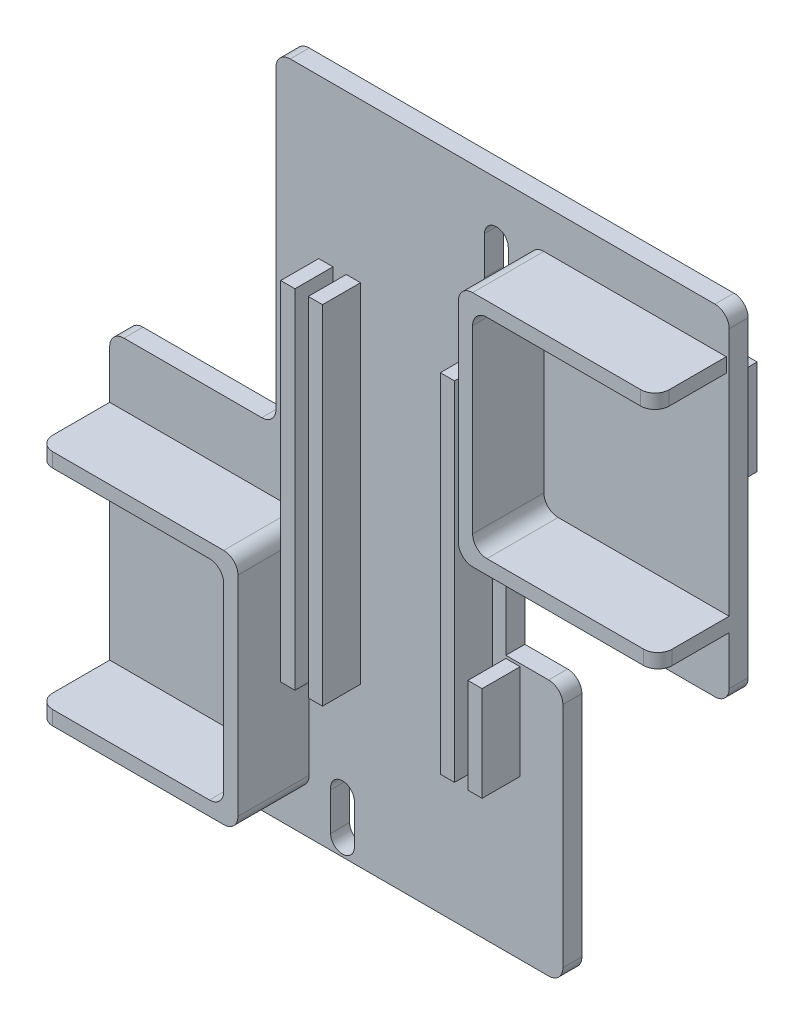
from build123d import *

# Parameters (mm, degrees)
SKETCH3_W             = 1.5
SKETCH3_H             = 36.6
BOSS_EXTRUDE1_DEPTH   = 4
BOSS_EXTRUDE1_2_DEPTH = 4
BOSS_EXTRUDE1_3_DEPTH = 4
BOSS_EXTRUDE1_4_DEPTH = 4
SKETCH4_W             = 65.2
SKETCH4_H             = 70
BOSS_EXTRUDE2_DEPTH   = 2
BOSS_EXTRUDE3_DEPTH   = 7.5
SKETCH6_W             = 17.5
SKETCH6_H             = 29.2
CUT_EXTRUDE1_DEPTH    = 4
SKETCH10_R            = 1.5
CUT_EXTRUDE5_DEPTH    = 20
SKETCH11_W            = 23.629808973
SKETCH11_H            = 13.794178538
SKETCH11_W_2          = 19.491555411
SKETCH11_H_2          = 12.733087881
CUT_EXTRUDE6_DEPTH    = 20
SKETCH13_W            = 4
SKETCH13_H            = 16.6
CUT_EXTRUDE7_DEPTH    = 2
SKETCH15_W            = 6
SKETCH15_H            = 11.6
CUT_EXTRUDE8_DEPTH    = 2
CUT_EXTRUDE9_DEPTH    = 2
FILLET1_R             = 1.5
CUT_EXTRUDE11_DEPTH   = 2
FILLET2_R             = 1.5
SKETCH19_W            = 10
SKETCH19_H            = 10
BOSS_EXTRUDE5_DEPTH   = 4.95


with BuildPart() as part:
    # Sketch3 → Boss-Extrude1 (new body)
    with BuildSketch(Plane.XY):
        with Locations((-6.95, 0)):
            Rectangle(SKETCH3_W, SKETCH3_H)
    extrude(amount=BOSS_EXTRUDE1_DEPTH)



with BuildPart() as body_2:
    # Sketch3 → Boss-Extrude1 2 (new body)
    with BuildSketch(Plane.XY):
        with Locations((-9.85, 0)):
            Rectangle(SKETCH3_W, SKETCH3_H)
    extrude(amount=BOSS_EXTRUDE1_2_DEPTH)


with BuildPart() as body_3:
    # Sketch3 → Boss-Extrude1 3 (new body)
    with BuildSketch(Plane.XY):
        with Locations((6.95, 0)):
            Rectangle(SKETCH3_W, SKETCH3_H)
    extrude(amount=BOSS_EXTRUDE1_3_DEPTH)


with BuildPart() as body_4:
    # Sketch3 → Boss-Extrude1 4 (new body)
    with BuildSketch(Plane.XY):
        with Locations((9.85, 0)):
            Rectangle(SKETCH3_W, SKETCH3_H)
    extrude(amount=BOSS_EXTRUDE1_4_DEPTH)


with BuildPart() as part_1:
    add(part.part)

    add(body_2.part)  # Boss-Extrude2 merges body 2

    add(body_3.part)  # Boss-Extrude2 merges body 3

    add(body_4.part)  # Boss-Extrude2 merges body 4
    # Sketch4 → Boss-Extrude2 (add)
    with BuildSketch(Plane.XY):
        Rectangle(SKETCH4_W, SKETCH4_H)
    extrude(amount=-BOSS_EXTRUDE2_DEPTH)

    # Sketch5 → Boss-Extrude3 (add)
    with BuildSketch(Plane.XY):
        Polygon((11.6, 30.8), (11.6, 5.8), (32.6, 5.8), (32.6, 7.3), (13.1, 7.3), (13.1, 29.3), (32.294650231, 29.3), (32.294650231, 30.8), align=None)
        Polygon((-32.6, -5.8), (-11.6, -5.8), (-11.6, -30.8), (-32.6, -30.8), (-32.6, -29.3), (-13.1, -29.3), (-13.1, -7.3), (-32.6, -7.3), align=None)
    extrude(amount=BOSS_EXTRUDE3_DEPTH)

    # Sketch6 → Cut-Extrude1 (cut)
    with BuildSketch(Plane.XY):
        with Locations((-23.85, 15.4)):
            Rectangle(SKETCH6_W, SKETCH6_H)
        with Locations((23.85, -15.4)):
            Rectangle(SKETCH6_W, SKETCH6_H)
    extrude(amount=-CUT_EXTRUDE1_DEPTH, mode=Mode.SUBTRACT)

    # Sketch10 → Cut-Extrude5 (cut)
    with BuildSketch(Plane(origin=(0, 0, -2), x_dir=(-1, 0, 0), z_dir=(0, 0, -1))):
        with Locations((-15.1, 27.3)):
            Circle(SKETCH10_R)
        with Locations((15.1, -27.3)):
            Circle(SKETCH10_R)
    extrude(amount=-CUT_EXTRUDE5_DEPTH, mode=Mode.SUBTRACT)

    # Sketch11 → Cut-Extrude6 (cut)
    with BuildSketch(Plane.XY):
        with Locations((-26.914904487, 32.734646762)):
            Rectangle(SKETCH11_W, SKETCH11_H)
        with Locations((24.845777706, -31.885774236)):
            Rectangle(SKETCH11_W_2, SKETCH11_H_2)
    extrude(amount=-CUT_EXTRUDE6_DEPTH, mode=Mode.SUBTRACT)

    # Sketch13 → Cut-Extrude7 (cut)
    with BuildSketch(Plane(origin=(10.6, 0, 0), x_dir=(0, 0, -1), z_dir=(1, 0, 0))):
        with Locations((-2, 0)):
            Rectangle(SKETCH13_W, SKETCH13_H)
    extrude(amount=-CUT_EXTRUDE7_DEPTH, mode=Mode.SUBTRACT)

    # Sketch15 → Cut-Extrude8 (cut)
    with BuildSketch(Plane.XY):
        with Locations((12.1, 0)):
            Rectangle(SKETCH15_W, SKETCH15_H)
    extrude(amount=-CUT_EXTRUDE8_DEPTH, mode=Mode.SUBTRACT)

    # Sketch16 → Cut-Extrude9 (cut)
    with BuildSketch(Plane.XY):
        with BuildLine():
            Line((-6.85, -29.3), (-6.85, -33.480622793))
            ThreePointArc((-6.85, -33.480622793), (-8.1, -34.730622793), (-9.35, -33.480622793))
            Line((-9.35, -33.480622793), (-9.33687818, -29.480644316))
            ThreePointArc((-9.33687818, -29.480644316), (-8.190560134, -28.053284771), (-6.85, -29.3))
        make_face()
        with BuildLine():
            Line((6.85, 29.3), (6.85, 25.3))
            ThreePointArc((6.85, 25.3), (8.1, 24.05), (9.35, 25.3))
            Line((9.35, 25.3), (9.35, 29.3))
            ThreePointArc((9.35, 29.3), (8.1, 30.55), (6.85, 29.3))
        make_face()
    extrude(amount=-CUT_EXTRUDE9_DEPTH, mode=Mode.SUBTRACT)

    # Fillet1
    fillet1_edges = [part_1.edges().sort_by_distance(p)[0] for p in [
        (32.6, 6.55, 7.5),
        (32.294650231, 30.05, 7.5),
        (-13.1, -7.3, 3.75),
        (-13.1, -29.3, 3.75),
        (-11.6, -30.8, 3.75),
        (-11.6, -5.8, 3.75),
        (-32.6, -6.55, 7.5),
        (-32.6, -30.05, 7.5),
        (-32.6, 0.8, -1),
        (-15.1, 0.8, -1),
        (32.6, -0.8, -1),
        (15.1, -0.8, -1),
        (-15.1, 35, -1),
        (15.1, -35, -1),
        (15.1, 5.8, -1),
        (15.1, -5.8, -1),
        (32.6, 35, -1),
        (-32.6, -35, -1),
        (11.6, 30.8, 3.75),
        (11.6, 5.8, 3.75),
        (13.1, 7.3, 3.75),
        (13.1, 29.3, 3.75),
    ]]
    fillet(fillet1_edges, radius=FILLET1_R)

    # Sketch18 → Cut-Extrude11 (cut)
    with BuildSketch(Plane.XY):
        Polygon((9.1, 8.3), (11.6, 8.3), (11.6, -5.8), (16.495460275, -5.8), (16.495460275, -8.011234459), (9.1, -8.011234459), align=None)
    extrude(amount=-CUT_EXTRUDE11_DEPTH, mode=Mode.SUBTRACT)

    # Fillet2
    fillet2_edges = [part_1.edges().sort_by_distance(p)[0] for p in [
        (11.6, 5.8, -1),
        (15.1, -8.011234459, -1),
    ]]
    fillet(fillet2_edges, radius=FILLET2_R)

    # Sketch19 → Boss-Extrude5 (add)
    with BuildSketch(Plane(origin=(0, 0, -2), x_dir=(-1, 0, 0), z_dir=(0, 0, -1))):
        with Locations((-23.6, 20)):
            Rectangle(SKETCH19_W, SKETCH19_H)
        with Locations((23.6, -20)):
            Rectangle(SKETCH19_W, SKETCH19_H)
    extrude(amount=BOSS_EXTRUDE5_DEPTH)


solid = part_1.part
